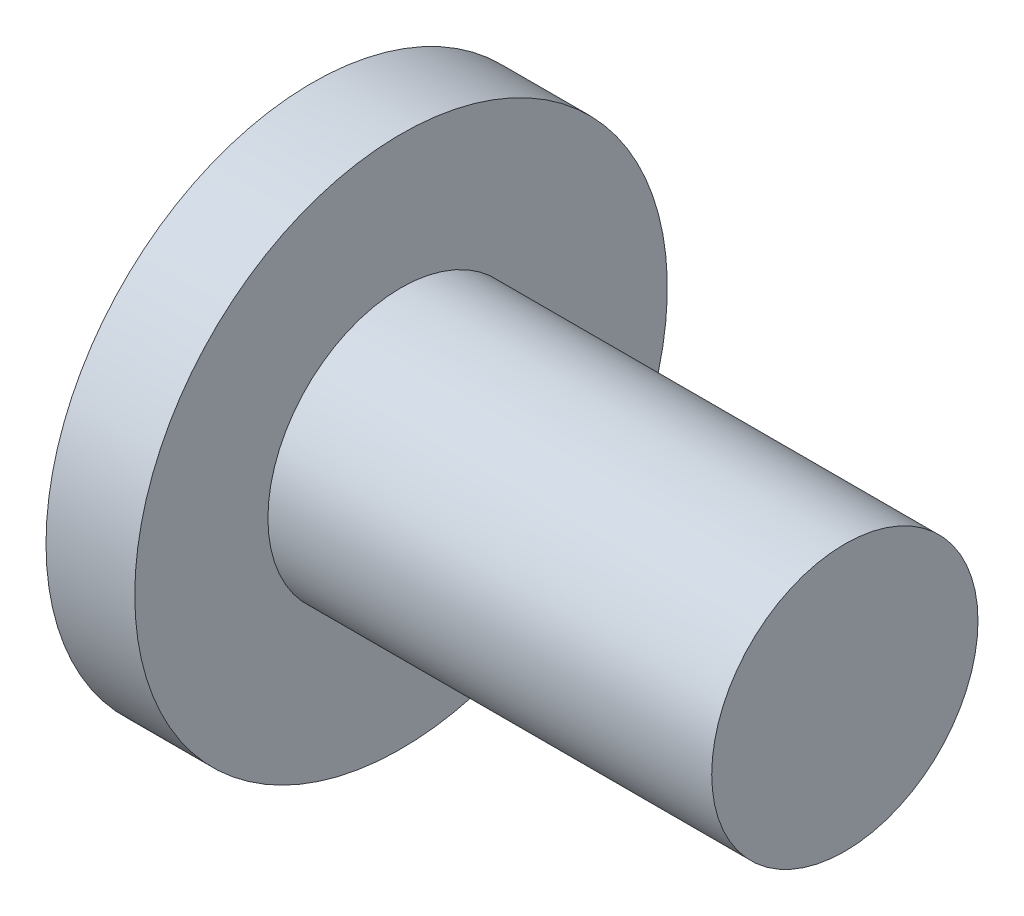
from build123d import *


with BuildPart() as part:
    # Sketch1 → Revolve1 (revolve)
    with BuildSketch(Plane.XY, mode=Mode.PRIVATE) as revolve1_sk:
        Polygon((0, 0), (0, 3), (-10, 3), (-10, 6), (-12, 6), (-12, 0), align=None)
    revolve(revolve1_sk.sketch.rotate(Axis((-12, 0, 0), (1, 0, 0)), 90), axis=Axis((-12, 0, 0), (1, 0, 0)))


solid = part.part
